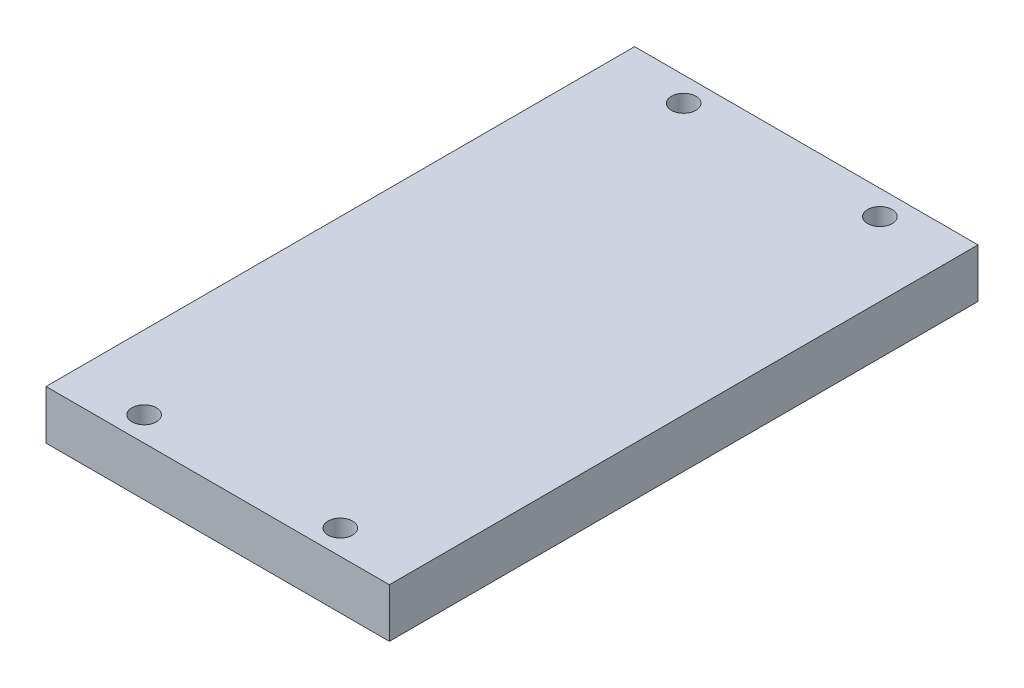
from build123d import *

# Parameters (mm, degrees)
SKETCH1_W           = 42
SKETCH1_H           = 72
BOSS_EXTRUDE1_DEPTH = 6
SKETCH2_R           = 1.5
CUT_EXTRUDE1_DEPTH  = 10


with BuildPart() as part:
    # Sketch1 → Boss-Extrude1 (new body)
    with BuildSketch(Plane(origin=(0, 0, 0), x_dir=(1, 0, 0), z_dir=(0, 1, 0))):
        Rectangle(SKETCH1_W, SKETCH1_H)
    extrude(amount=BOSS_EXTRUDE1_DEPTH)

    # Sketch2 → Cut-Extrude1 (cut)
    with BuildSketch(Plane(origin=(0, 6, 0), x_dir=(1, 0, 0), z_dir=(0, 1, 0))):
        with Locations(Location((-12, -33, 0), (0, 0, 270))):
            Circle(SKETCH2_R)
        with Locations(Location((12, -33, 0), (0, 0, 270))):
            Circle(SKETCH2_R)
        with Locations(Location((12, 33, 0), (0, 0, 270))):
            Circle(SKETCH2_R)
        with Locations(Location((-12, 33, 0), (0, 0, 270))):
            Circle(SKETCH2_R)
    extrude(amount=-CUT_EXTRUDE1_DEPTH, mode=Mode.SUBTRACT)


solid = part.part
